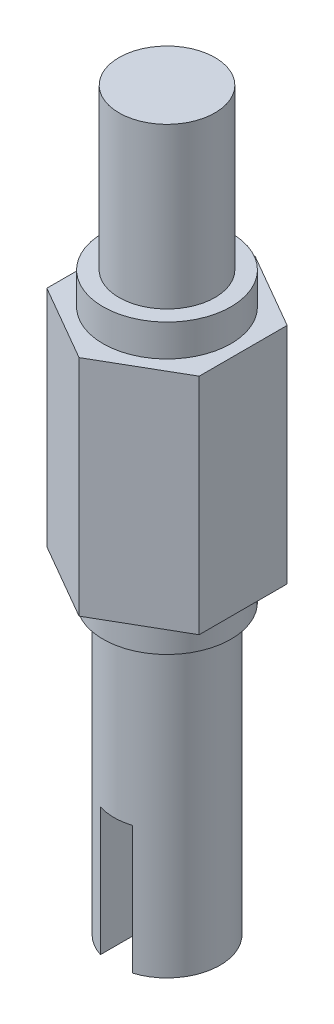
from build123d import *

# Parameters (mm, degrees)
BOSS_EXTRUDE1_DEPTH = 14
SKETCH4_R           = 4
BOSS_EXTRUDE2_DEPTH = 2
SKETCH4_7_R         = 3.314528
BOSS_EXTRUDE3_DEPTH = 12
BOSS_EXTRUDE5_START = 2
SKETCH5_R           = 4
SKETCH5_R_2         = 3
BOSS_EXTRUDE5_DEPTH = 2
SKETCH5_4_R         = 3
BOSS_EXTRUDE6_DEPTH = 12
BOSS_EXTRUDE7_DEPTH = 20


with BuildPart() as part:
    # Sketch1 → Boss-Extrude1 (new body)
    with BuildSketch(Plane(origin=(0, 0, 0), x_dir=(1, 0, 0), z_dir=(0, 1, 0))):
        Polygon((4.7625, -2.749631), (4.7625, 2.749631), (0, 5.499261), (-4.7625, 2.749631), (-4.7625, -2.749631), (0, -5.499261), align=None)
    extrude(amount=BOSS_EXTRUDE1_DEPTH)

    # Sketch4 → Boss-Extrude2 (add)
    with BuildSketch(Plane.XZ):
        with Locations(Location((0, 0, 0), (0, 0, 270))):
            Circle(SKETCH4_R)
    extrude(amount=BOSS_EXTRUDE2_DEPTH)

    # Sketch4<7> → Boss-Extrude3 (add)
    with BuildSketch(Plane.XZ):
        with Locations(Location((0, 0, 0), (0, 0, 270))):
            Circle(SKETCH4_7_R)
        with BuildLine():
            Line((-1, 3.160079), (-1, 1.160079))
            Line((-1, 1.160079), (1, 1.160079))
            Line((1, 1.160079), (1, 3.160079))
            ThreePointArc((1, 3.160079), (0, -3.314528), (-1, 3.160079))
        make_face()
    extrude(amount=BOSS_EXTRUDE3_DEPTH)

    # Sketch5 → Boss-Extrude5 (add)
    # profile 1 of 2: a face of its own
    with BuildSketch(Plane(origin=(0, 14, 0), x_dir=(1, 0, 0), z_dir=(0, 1, 0)).offset(BOSS_EXTRUDE5_START)):
        with Locations(Location((0, 0, 0), (0, 0, 90))):
            Circle(SKETCH5_R)
        Circle(SKETCH5_R_2, mode=Mode.SUBTRACT)
    # profile 2 of 2: a face of its own
    with BuildSketch(Plane(origin=(0, 14, 0), x_dir=(1, 0, 0), z_dir=(0, 1, 0)).offset(BOSS_EXTRUDE5_START)):
        Circle(SKETCH5_R_2)
    extrude(amount=-BOSS_EXTRUDE5_DEPTH)

    # Sketch5<4> → Boss-Extrude6 (add)
    with BuildSketch(Plane(origin=(0, 14, 0), x_dir=(1, 0, 0), z_dir=(0, 1, 0))):
        with Locations(Location((0, 0, 0), (0, 0, 270))):
            Circle(SKETCH5_4_R)
    extrude(amount=BOSS_EXTRUDE6_DEPTH)

    # Sketch4<13> → Boss-Extrude7 (add)
    with BuildSketch(Plane.XZ):
        with BuildLine():
            Line((-1, 3.160079), (-1, 1.160079))
            Line((-1, 1.160079), (1, 1.160079))
            Line((1, 1.160079), (1, 3.160079))
            ThreePointArc((1, 3.160079), (0, -3.314528), (-1, 3.160079))
        make_face()
    extrude(amount=BOSS_EXTRUDE7_DEPTH)


solid = part.part
